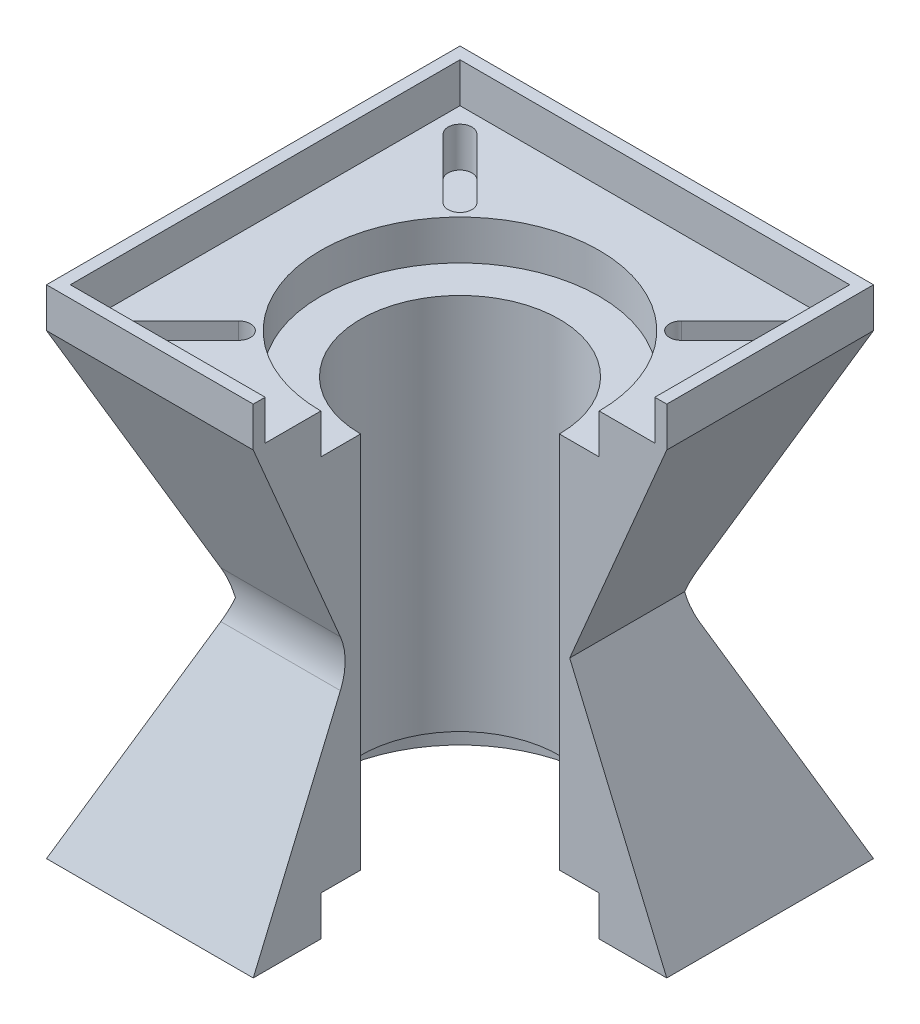
from build123d import *

# Parameters (mm, degrees)
SKETCH1_W           = 104
SKETCH1_H           = 104
BOSS_EXTRUDE1_DEPTH = 115
CUT_EXTRUDE1_DEPTH  = 164.538986178
CUT_EXTRUDE2_DEPTH  = 57.5
SKETCH4_R           = 25
CUT_EXTRUDE3_DEPTH  = 137.502747225
SKETCH5_R           = 35
CUT_EXTRUDE4_DEPTH  = 10
CUT_EXTRUDE5_START  = -10
SKETCH6_R           = 35
CUT_EXTRUDE5_DEPTH  = 10
SKETCH7_W           = 52
SKETCH7_H           = 52
CUT_EXTRUDE6_DEPTH  = 137.502747225
FILLET2_R           = 15
FILLET3_R           = 15
BOSS_EXTRUDE2_DEPTH = 10
CUT_EXTRUDE7_DEPTH  = 10


with BuildPart() as part:
    # Sketch1 → Boss-Extrude1 (new body)
    with BuildSketch(Plane(origin=(0, 0, 0), x_dir=(1, 0, 0), z_dir=(0, 1, 0))):
        Rectangle(SKETCH1_W, SKETCH1_H)
    extrude(amount=BOSS_EXTRUDE1_DEPTH)

    # Sketch2 → Cut-Extrude1 (cut, through all)
    with BuildSketch(Plane(origin=(52, 0, 0), x_dir=(0, 0, -1), z_dir=(1, 0, 0))):
        Polygon((-52, 115), (-52, 0), (-27.592698068, 57.5), align=None)
        Polygon((52, 115), (52, 0), (27.592698068, 57.5), align=None)
    extrude(amount=-CUT_EXTRUDE1_DEPTH, mode=Mode.SUBTRACT)

    # Sketch3 → Cut-Extrude2 (cut, symmetric)
    with BuildSketch(Plane.XY):
        Polygon((-52, 115), (-27.592698068, 57.5), (-52, 0), align=None)
        Polygon((52, 0), (27.592698068, 57.5), (52, 115), align=None)
    extrude(amount=CUT_EXTRUDE2_DEPTH, both=True, mode=Mode.SUBTRACT)

    # Sketch4 → Cut-Extrude3 (cut, through all)
    with BuildSketch(Plane(origin=(0, 115, 0), x_dir=(1, 0, 0), z_dir=(0, 1, 0))):
        with Locations(Location((0, 0, 0), (0, 0, 270))):
            Circle(SKETCH4_R)
    extrude(amount=-CUT_EXTRUDE3_DEPTH, mode=Mode.SUBTRACT)

    # Sketch5 → Cut-Extrude4 (cut)
    with BuildSketch(Plane(origin=(0, 115, 0), x_dir=(1, 0, 0), z_dir=(0, 1, 0))):
        with Locations(Location((0, 0, 0), (0, 0, 270))):
            Circle(SKETCH5_R)
    extrude(amount=-CUT_EXTRUDE4_DEPTH, mode=Mode.SUBTRACT)

    # Sketch6 → Cut-Extrude5 (cut)
    with BuildSketch(Plane.XZ.offset(CUT_EXTRUDE5_START)):
        with Locations(Location((0, 0, 0), (0, 0, 90))):
            Circle(SKETCH6_R)
    extrude(amount=CUT_EXTRUDE5_DEPTH, mode=Mode.SUBTRACT)

    # Sketch7 → Cut-Extrude6 (cut, through all)
    with BuildSketch(Plane(origin=(0, 115, 0), x_dir=(1, 0, 0), z_dir=(0, 1, 0))):
        with Locations((26, -26)):
            Rectangle(SKETCH7_W, SKETCH7_H)
    extrude(amount=-CUT_EXTRUDE6_DEPTH, mode=Mode.SUBTRACT)

    # Fillet2
    fillet2_edges = [part.edges().sort_by_distance(p)[0] for p in [
        (0, 57.5, -27.592698068),
    ]]
    fillet(fillet2_edges, radius=FILLET2_R)

    # Fillet3
    fillet3_edges = [part.edges().sort_by_distance(p)[0] for p in [
        (-13.796349034, 57.5, 27.592698068),
    ]]
    fillet(fillet3_edges, radius=FILLET3_R)

    # Sketch8 → Boss-Extrude2 (add)
    with BuildSketch(Plane(origin=(0, 115, 0), x_dir=(1, 0, 0), z_dir=(0, 1, 0))):
        Polygon((-49, 49), (49, 49), (49, 0), (52, 0), (52, 52), (-52, 52), (-52, -52), (0, -52), (0, -49), (-49, -49), align=None)
    extrude(amount=BOSS_EXTRUDE2_DEPTH)

    # Sketch9 → Cut-Extrude7 (cut)
    with BuildSketch(Plane(origin=(0, 115, 0), x_dir=(1, 0, 0), z_dir=(0, 1, 0))):
        with BuildLine():
            Line((-40.734018716, 44.976659403), (-25.734018716, 29.976659403))
            ThreePointArc((-25.734018716, 29.976659403), (-25.734018716, 25.734018716), (-29.976659403, 25.734018716))
            Line((-29.976659403, 25.734018716), (-44.976659403, 40.734018716))
            ThreePointArc((-44.976659403, 40.734018716), (-44.976659403, 44.976659403), (-40.734018716, 44.976659403))
        make_face()
        with BuildLine():
            Line((44.976659403, 40.734018716), (29.976659403, 25.734018716))
            ThreePointArc((29.976659403, 25.734018716), (25.734018716, 25.734018716), (25.734018716, 29.976659403))
            Line((25.734018716, 29.976659403), (40.734018716, 44.976659403))
            ThreePointArc((40.734018716, 44.976659403), (44.976659403, 44.976659403), (44.976659403, 40.734018716))
        make_face()
        with BuildLine():
            Line((-44.976659403, -40.734018716), (-29.976659403, -25.734018716))
            ThreePointArc((-29.976659403, -25.734018716), (-25.734018716, -25.734018716), (-25.734018716, -29.976659403))
            Line((-25.734018716, -29.976659403), (-40.734018716, -44.976659403))
            ThreePointArc((-40.734018716, -44.976659403), (-44.976659403, -44.976659403), (-44.976659403, -40.734018716))
        make_face()
    extrude(amount=-CUT_EXTRUDE7_DEPTH, mode=Mode.SUBTRACT)


solid = part.part
